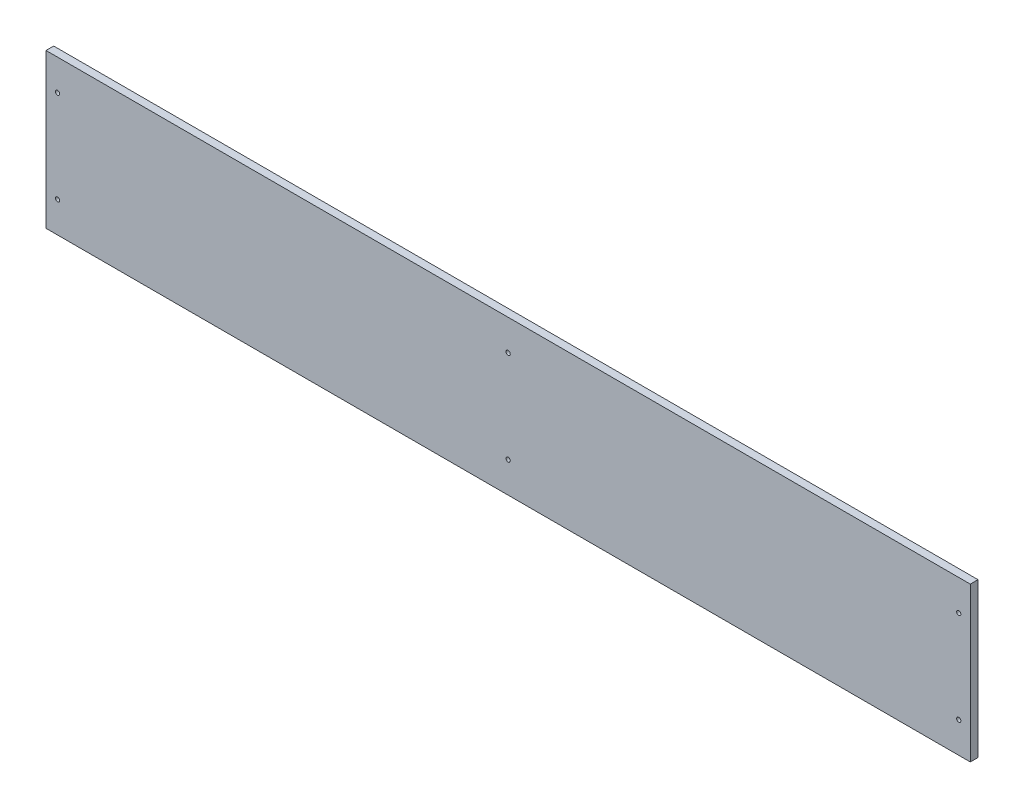
from build123d import *

# Parameters (mm, degrees)
ESQUISSE1_W             = 1200
ESQUISSE1_H             = 200
BOSS_EXTRU_1_DEPTH      = 10
ESQUISSE2_R             = 2.75
ENL_V_MAT_EXTRU_1_DEPTH = 10
CHANFREIN1_SIZE         = 2.5


with BuildPart() as part:
    # Esquisse1 → Boss.-Extru.1 (new body)
    with BuildSketch(Plane.XY):
        with Locations((600, -100)):
            Rectangle(ESQUISSE1_W, ESQUISSE1_H)
    extrude(amount=BOSS_EXTRU_1_DEPTH)

    # Esquisse2 → Enlèv. mat.-Extru.1 (cut)
    with BuildSketch(Plane.XY.offset(10)):
        with Locations((15, -40)):
            Circle(ESQUISSE2_R)
        with Locations((15, -160)):
            Circle(ESQUISSE2_R)
        with Locations((1185, -40)):
            Circle(ESQUISSE2_R)
        with Locations((1185, -160)):
            Circle(ESQUISSE2_R)
        with Locations((600, -40)):
            Circle(ESQUISSE2_R)
        with Locations((600, -160)):
            Circle(ESQUISSE2_R)
    extrude(amount=-ENL_V_MAT_EXTRU_1_DEPTH, mode=Mode.SUBTRACT)

    # Chanfrein1
    chanfrein1_edges = [part.edges().sort_by_distance(p)[0] for p in [
        (12.25, -40, 0),
        (597.25, -160, 0),
        (597.25, -40, 0),
        (1182.25, -160, 0),
        (1182.25, -40, 0),
        (12.25, -160, 0),
    ]]
    chamfer(chanfrein1_edges, length=CHANFREIN1_SIZE)


solid = part.part
